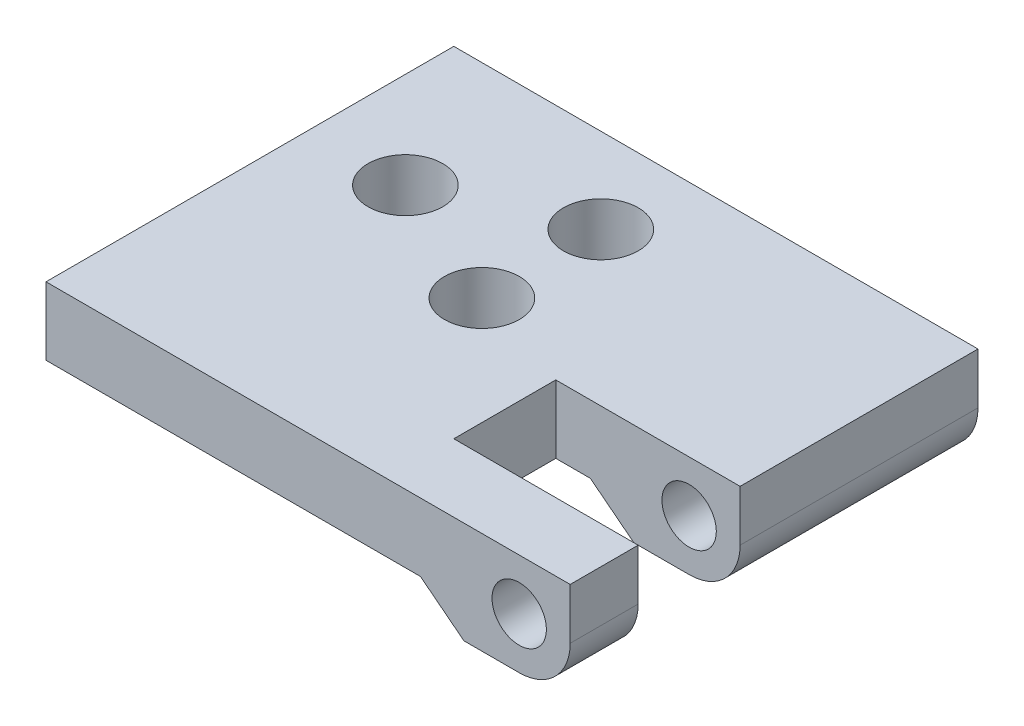
from build123d import *

# Parameters (mm, degrees)
SKETCH_1_R          = 2.2
EXTRUDE_2_DEPTH     = 6
SKETCH_2_R          = 1.6
CUT_EXTRUDE_2_DEPTH = 26
SKETCH_3_W          = 22.036316786
SKETCH_3_H          = 24
CUT_EXTRUDE_3_DEPTH = 2
CUT_EXTRUDE_4_DEPTH = 27
CUT_EXTRUDE_7_DEPTH = 24
EXTRUDE_4_DEPTH     = 24
SKETCH_9_W          = 6
SKETCH_9_H          = 5.089389346
CUT_EXTRUDE_8_DEPTH = 24


with BuildPart() as part:
    # 草图1 → 凸台-拉伸2 (new body)
    with BuildSketch(Plane(origin=(0, 0, 0), x_dir=(1, 0, 0), z_dir=(0, 1, 0))):
        Polygon((4.305555556, 9.700757576), (-25.694444444, 9.700757576), (-25.694444444, -14.299242424), (4.305555556, -14.299242424), (4.305555556, -10.299242424), (-5.694444444, -10.299242424), (-5.694444444, -4.299242424), (4.305555556, -4.299242424), align=None)
        with Locations(Location((-12.043257461, -2.299242424, 0), (0, 0, 270))):
            Circle(SKETCH_1_R, mode=Mode.SUBTRACT)
        with Locations(Location((-20.043257461, 1.200757576, 0), (0, 0, 270))):
            Circle(SKETCH_1_R, mode=Mode.SUBTRACT)
        with Locations(Location((-12.043257461, 4.700757576, 0), (0, 0, 270))):
            Circle(SKETCH_1_R, mode=Mode.SUBTRACT)
    extrude(amount=EXTRUDE_2_DEPTH)

    # 草图2 → 切除-拉伸2 (cut)
    with BuildSketch(Plane.XY.offset(14.299242424)):
        with Locations((2.152777778, 3)):
            Circle(SKETCH_2_R)
    extrude(amount=-CUT_EXTRUDE_2_DEPTH, mode=Mode.SUBTRACT)

    # 草图3 → 切除-拉伸3 (cut)
    with BuildSketch(Plane.XZ):
        with Locations((-14.676286051, 2.299242424)):
            Rectangle(SKETCH_3_W, SKETCH_3_H)
    extrude(amount=-CUT_EXTRUDE_3_DEPTH, mode=Mode.SUBTRACT)

    # 草图4 → 切除-拉伸4 (cut)
    with BuildSketch(Plane.XY.offset(14.299242424)):
        Polygon((-1.100112358, 0), (-3.658127658, 2), (-3.658127658, 0), align=None)
    extrude(amount=-CUT_EXTRUDE_4_DEPTH, mode=Mode.SUBTRACT)

    # 草图5 → 切除-拉伸7 (cut)
    with BuildSketch(Plane(origin=(0, 0, -9.700757576), x_dir=(-1, 0, 0), z_dir=(0, 0, -1))):
        with BuildLine():
            Line((-2.152777778, 0), (-4.305555556, 0))
            Line((-4.305555556, 0), (-4.305555556, 0.910610654))
            ThreePointArc((-4.305555556, 0.910610654), (-3.32150186, 0.237015378), (-2.152777778, 0))
        make_face()
    extrude(amount=-CUT_EXTRUDE_7_DEPTH, mode=Mode.SUBTRACT)

    # 草图8 → 凸台-拉伸4 (add)
    with BuildSketch(Plane(origin=(0, 0, -9.700757576), x_dir=(-1, 0, 0), z_dir=(0, 0, -1))):
        with BuildLine():
            ThreePointArc((-4.305555556, 0.910610654), (-4.932915664, 1.872687562), (-5.152777778, 3))
            Line((-5.152777778, 3), (-5.152777778, 6))
            Line((-5.152777778, 6), (-4.305555556, 6))
            Line((-4.305555556, 6), (-4.305555556, 0.910610654))
        make_face()
    extrude(amount=-EXTRUDE_4_DEPTH)

    # 草图9 → 切除-拉伸8 (cut)
    with BuildSketch(Plane.ZY.offset(-4.305555556)):
        with Locations((7.299242424, 3.455305327)):
            Rectangle(SKETCH_9_W, SKETCH_9_H)
    extrude(amount=-CUT_EXTRUDE_8_DEPTH, mode=Mode.SUBTRACT)


solid = part.part
